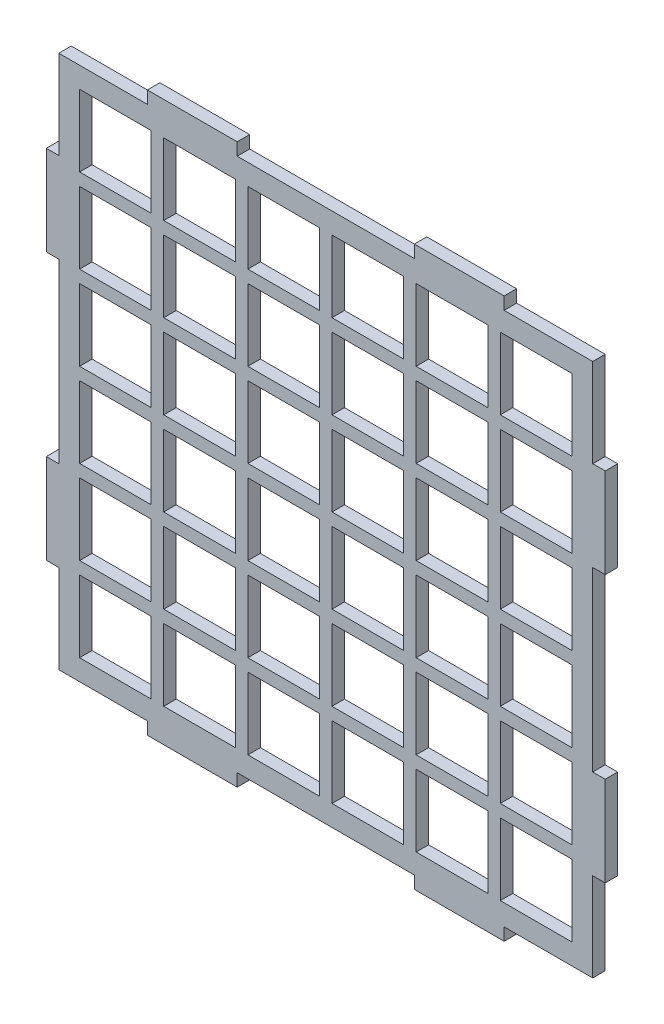
from build123d import *

# Parameters (mm, degrees)
BOSS_EXTRUDE1_DEPTH = 3
SKETCH2_W           = 17.216666667
SKETCH2_H           = 17.216666667
SKETCH2_W_2         = 17.216666666
SKETCH2_H_2         = 17.216666666
CUT_EXTRUDE1_DEPTH  = 96.011815055


with BuildPart() as part:
    # Sketch1 → Boss-Extrude1 (new body)
    with BuildSketch(Plane.XY):
        Polygon((0, -64.15), (-21.283333333, -64.15), (-21.283333333, -67.15), (-42.866666667, -67.15), (-42.866666667, -64.15), (-64.15, -64.15), (-64.15, -42.866666667), (-67.15, -42.866666667), (-67.15, -21.283333333), (-64.15, -21.283333333), (-64.15, 0), (-64.15, 21.283333333), (-67.15, 21.283333333), (-67.15, 42.866666667), (-64.15, 42.866666667), (-64.15, 64.15), (-42.866666667, 64.15), (-42.866666667, 67.15), (-21.283333333, 67.15), (-21.283333333, 64.15), (0, 64.15), (21.283333333, 64.15), (21.283333333, 67.15), (42.866666667, 67.15), (42.866666667, 64.15), (64.15, 64.15), (64.15, 42.866666667), (67.15, 42.866666667), (67.15, 21.283333333), (64.15, 21.283333333), (64.15, 0), (64.15, -21.283333333), (67.15, -21.283333333), (67.15, -42.866666667), (64.15, -42.866666667), (64.15, -64.15), (42.866666667, -64.15), (42.866666667, -67.15), (21.283333333, -67.15), (21.283333333, -64.15), align=None)
    extrude(amount=BOSS_EXTRUDE1_DEPTH)

    # Sketch2 → Cut-Extrude1 (cut, through all)
    with BuildSketch(Plane.XY.offset(3)):
        with Locations((-50.541666667, 50.541666667)):
            Rectangle(SKETCH2_W, SKETCH2_H)
        with Locations((-30.325, 50.541666667)):
            Rectangle(SKETCH2_W_2, SKETCH2_H)
        with Locations((-10.108333334, 50.541666667)):
            Rectangle(SKETCH2_W, SKETCH2_H)
        with Locations((10.108333334, 50.541666667)):
            Rectangle(SKETCH2_W, SKETCH2_H)
        with Locations((30.325, 50.541666667)):
            Rectangle(SKETCH2_W_2, SKETCH2_H)
        with Locations((50.541666667, 50.541666667)):
            Rectangle(SKETCH2_W, SKETCH2_H)
        with Locations((-30.325, 30.325)):
            Rectangle(SKETCH2_W_2, SKETCH2_H_2)
        with Locations((-10.108333334, 30.325)):
            Rectangle(SKETCH2_W, SKETCH2_H_2)
        with Locations((10.108333334, 30.325)):
            Rectangle(SKETCH2_W, SKETCH2_H_2)
        with Locations((30.325, 30.325)):
            Rectangle(SKETCH2_W_2, SKETCH2_H_2)
        with Locations((50.541666667, 30.325)):
            Rectangle(SKETCH2_W, SKETCH2_H_2)
        with Locations((-30.325, 10.108333334)):
            Rectangle(SKETCH2_W_2, SKETCH2_H)
        with Locations((-10.108333334, 10.108333334)):
            Rectangle(SKETCH2_W, SKETCH2_H)
        with Locations((10.108333334, 10.108333334)):
            Rectangle(SKETCH2_W, SKETCH2_H)
        with Locations((30.325, 10.108333334)):
            Rectangle(SKETCH2_W_2, SKETCH2_H)
        with Locations((50.541666667, 10.108333334)):
            Rectangle(SKETCH2_W, SKETCH2_H)
        with Locations((-30.325, -10.108333334)):
            Rectangle(SKETCH2_W_2, SKETCH2_H)
        with Locations((-10.108333334, -10.108333334)):
            Rectangle(SKETCH2_W, SKETCH2_H)
        with Locations((10.108333334, -10.108333334)):
            Rectangle(SKETCH2_W, SKETCH2_H)
        with Locations((30.325, -10.108333334)):
            Rectangle(SKETCH2_W_2, SKETCH2_H)
        with Locations((50.541666667, -10.108333334)):
            Rectangle(SKETCH2_W, SKETCH2_H)
        with Locations((-30.325, -30.325)):
            Rectangle(SKETCH2_W_2, SKETCH2_H_2)
        with Locations((-10.108333334, -30.325)):
            Rectangle(SKETCH2_W, SKETCH2_H_2)
        with Locations((10.108333334, -30.325)):
            Rectangle(SKETCH2_W, SKETCH2_H_2)
        with Locations((30.325, -30.325)):
            Rectangle(SKETCH2_W_2, SKETCH2_H_2)
        with Locations((50.541666667, -30.325)):
            Rectangle(SKETCH2_W, SKETCH2_H_2)
        with Locations((-30.325, -50.541666667)):
            Rectangle(SKETCH2_W_2, SKETCH2_H)
        with Locations((-10.108333334, -50.541666667)):
            Rectangle(SKETCH2_W, SKETCH2_H)
        with Locations((10.108333334, -50.541666667)):
            Rectangle(SKETCH2_W, SKETCH2_H)
        with Locations((30.325, -50.541666667)):
            Rectangle(SKETCH2_W_2, SKETCH2_H)
        with Locations((50.541666667, -50.541666667)):
            Rectangle(SKETCH2_W, SKETCH2_H)
        with Locations((-50.541666667, 30.325)):
            Rectangle(SKETCH2_W, SKETCH2_H_2)
        with Locations((-50.541666667, 10.108333334)):
            Rectangle(SKETCH2_W, SKETCH2_H)
        with Locations((-50.541666667, -10.108333334)):
            Rectangle(SKETCH2_W, SKETCH2_H)
        with Locations((-50.541666667, -30.325)):
            Rectangle(SKETCH2_W, SKETCH2_H_2)
        with Locations((-50.541666667, -50.541666667)):
            Rectangle(SKETCH2_W, SKETCH2_H)
    extrude(amount=-CUT_EXTRUDE1_DEPTH, mode=Mode.SUBTRACT)


solid = part.part
